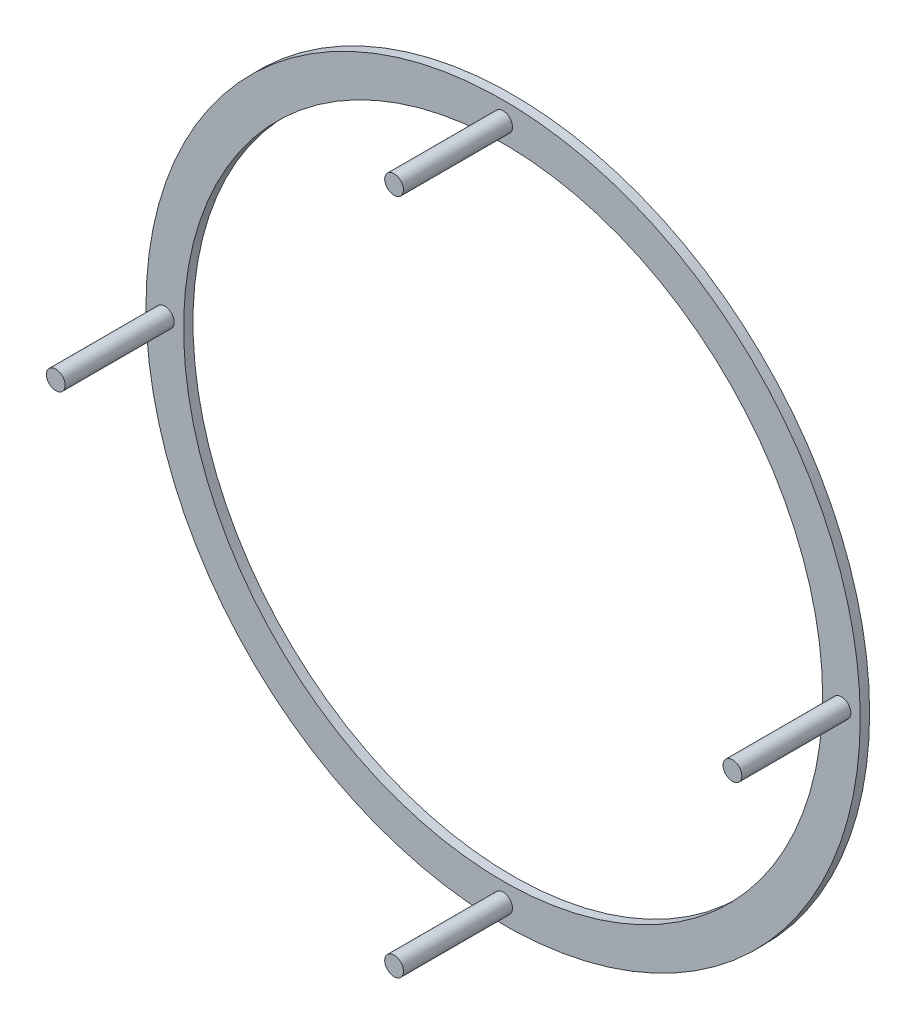
from build123d import *

# Parameters (mm, degrees)
SKETCH_1_R      = 190
SKETCH_1_R_2    = 170
EXTRUDE_2_DEPTH = 5
SKETCH_2_R      = 5
EXTRUDE_3_DEPTH = 58


with BuildPart() as part:
    # 草图1 → 凸台-拉伸2 (new body)
    with BuildSketch(Plane.XY):
        Circle(SKETCH_1_R)
        Circle(SKETCH_1_R_2, mode=Mode.SUBTRACT)
    extrude(amount=EXTRUDE_2_DEPTH)

    # 草图2 → 凸台-拉伸3 (add)
    with BuildSketch(Plane.XY.offset(5)):
        with Locations(Location((0, 180, 0), (0, 0, 180))):
            Circle(SKETCH_2_R)
        with Locations(Location((-180, 0, 0), (0, 0, 180))):
            Circle(SKETCH_2_R)
        with Locations(Location((0, -180, 0), (0, 0, 180))):
            Circle(SKETCH_2_R)
        with Locations(Location((180, 0, 0), (0, 0, 180))):
            Circle(SKETCH_2_R)
    extrude(amount=EXTRUDE_3_DEPTH)


solid = part.part
